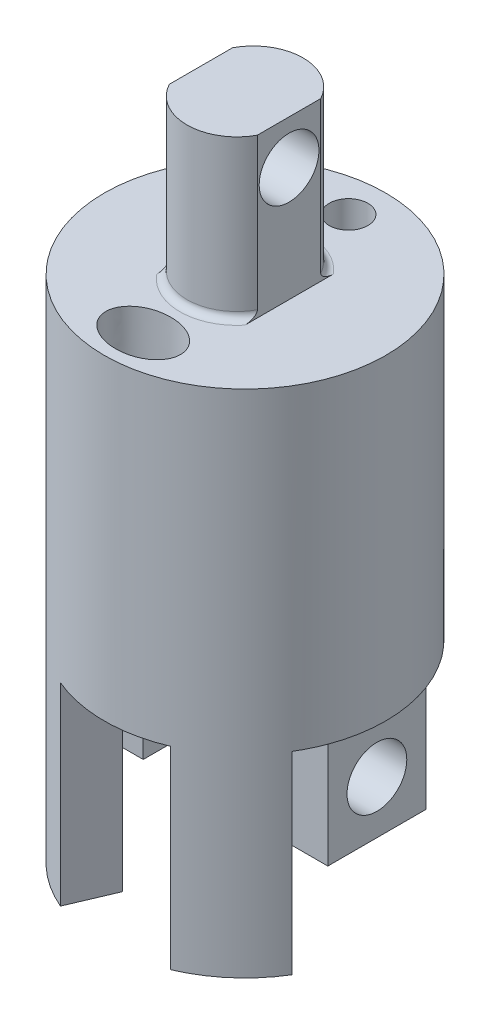
from build123d import *
from build123d.topology import SkipClean

# Parameters (mm, degrees)
SKETCH2_R           = 8
BOSS_EXTRUDE1_DEPTH = 18
BOSS_EXTRUDE3_DEPTH = 9
FILLET1_R           = 0.4
SKETCH12_R          = 1.1
CUT_EXTRUDE2_DEPTH  = 30.274562429
SKETCH13_R          = 1.7
CUT_EXTRUDE3_DEPTH  = 31.055691415
SKETCH14_W          = 4.5
SKETCH14_H          = 5.58
BOSS_EXTRUDE5_DEPTH = 6
SKETCH15_R          = 1.7
CUT_EXTRUDE4_DEPTH  = 33.143110095
SKETCH18_RX         = 2.125
SKETCH18_RY         = 1.56360128
CUT_EXTRUDE5_DEPTH  = 27.532998323
BOSS_EXTRUDE6_START = 11
BOSS_EXTRUDE6_DEPTH = 11
CUT_EXTRUDE6_DEPTH  = 3.5


with BuildPart() as part:
    # Sketch2 → Boss-Extrude1 (new body)
    with BuildSketch(Plane(origin=(0, 0, 0), x_dir=(1, 0, 0), z_dir=(0, 1, 0))):
        with Locations(Location((0, 0, 0), (0, 0, 270))):
            Circle(SKETCH2_R)
    extrude(amount=BOSS_EXTRUDE1_DEPTH)

    # Sketch4 → Boss-Extrude3 (add)
    with BuildSketch(Plane(origin=(0, 18, 0), x_dir=(1, 0, 0), z_dir=(0, 1, 0))):
        with BuildLine():
            Line((2.504502892, -1.8), (2.504502892, 1.8))
            ThreePointArc((2.504502892, 1.8), (0, 3.30267653), (-2.504502892, 1.8))
            Line((-2.504502892, 1.8), (-2.504502892, -1.8))
            ThreePointArc((-2.504502892, -1.8), (0, -3.30267653), (2.504502892, -1.8))
        make_face()
    extrude(amount=BOSS_EXTRUDE3_DEPTH)

    # Fillet1
    fillet1_edges = [part.edges().sort_by_distance(p)[0] for p in [
        (0, 18, -3.30267653),
        (0, 18, 3.30267653),
    ]]
    fillet(fillet1_edges, radius=FILLET1_R)

    # Sketch12 → Cut-Extrude2 (cut, through all)
    with BuildSketch(Plane(origin=(0, 0, 0), x_dir=(1, 0, 0), z_dir=(0, 1, 0))):
        with Locations(Location((0, 5.887857779, 0), (0, 0, 270))):
            Circle(SKETCH12_R)
    extrude(amount=CUT_EXTRUDE2_DEPTH, mode=Mode.SUBTRACT)

    # Sketch13 → Cut-Extrude3 (cut, through all)
    with BuildSketch(Plane.ZY.offset(2.504502892)):
        with Locations((0, 24.5)):
            Circle(SKETCH13_R)
    extrude(amount=-CUT_EXTRUDE3_DEPTH, mode=Mode.SUBTRACT)

    # Sketch14 → Boss-Extrude5 (add)
    with BuildSketch(Plane.XZ):
        with Locations((-5.247726322, 0)):
            Rectangle(SKETCH14_W, SKETCH14_H)
        with Locations((5.247726322, 0)):
            Rectangle(SKETCH14_W, SKETCH14_H)
    extrude(amount=BOSS_EXTRUDE5_DEPTH)

    # Sketch15 → Cut-Extrude4 (cut, through all)
    with BuildSketch(Plane(origin=(7.497726322, 0, 0), x_dir=(0, 0, -1), z_dir=(1, 0, 0))):
        with Locations((0, -3)):
            Circle(SKETCH15_R)
    extrude(amount=-CUT_EXTRUDE4_DEPTH, mode=Mode.SUBTRACT)

    # Sketch18 → Cut-Extrude5 (cut, through all)
    with BuildSketch(Plane(origin=(0, 18, 0), x_dir=(1, 0, 0), z_dir=(0, 1, 0))):
        with Locations(Location((0, -5.788604863), (0, 0, 180))):
            Ellipse(SKETCH18_RX, SKETCH18_RY)
    extrude(amount=-CUT_EXTRUDE5_DEPTH, mode=Mode.SUBTRACT)

    # Sketch19 → Boss-Extrude6 (add)
    with SkipClean():  # the faces are left unmerged after this step: merging them gives an invalid solid
        with BuildSketch(Plane.XZ.offset(BOSS_EXTRUDE6_START)):
            with BuildLine():
                Line((-6.832550312, 4.1612806), (-4.998986356, 3.04457106))
                ThreePointArc((-4.998986356, 3.04457106), (-3.54196191, 3.971164487), (-2.080323071, 4.890461784))
                Line((-2.080323071, 4.890461784), (-3.131517904, 7.361629956))
                ThreePointArc((-3.131517904, 7.361629956), (-5.232707029, 6.051345069), (-6.832550312, 4.1612806))
            make_face()
            with BuildLine():
                Line((3.131517904, 7.361629956), (2.080323071, 4.890461784))
                ThreePointArc((2.080323071, 4.890461784), (3.54196191, 3.971164487), (4.998986356, 3.04457106))
                Line((4.998986356, 3.04457106), (6.832550312, 4.1612806))
                ThreePointArc((6.832550312, 4.1612806), (5.232707029, 6.051345069), (3.131517904, 7.361629956))
            make_face()
        extrude(amount=-BOSS_EXTRUDE6_DEPTH)

    # Sketch20 → Cut-Extrude6 (cut)
    with SkipClean():  # the faces are left unmerged after this step: merging them gives an invalid solid
        with BuildSketch(Plane.XZ):
            Polygon((2.911854561, -2.79), (2.911854561, 2.79), (2.911854561, 4.372678458), (-2.997726322, 4.372678458), (-2.997726322, 2.79), (-2.997726322, -2.79), (-2.997726322, -4.306263787), (2.911854561, -4.306263787), align=None)
        extrude(amount=-CUT_EXTRUDE6_DEPTH, mode=Mode.SUBTRACT)


solid = part.part
